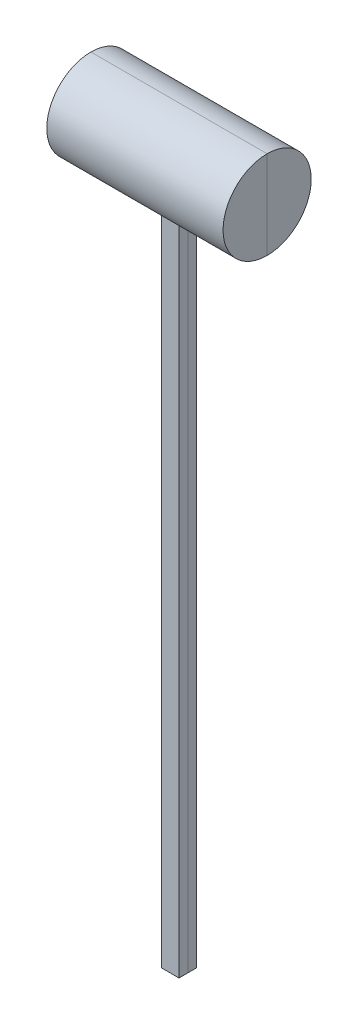
from build123d import *

# Parameters (mm, degrees)
SKETCH1_R           = 5
BOSS_EXTRUDE1_DEPTH = 10
SKETCH2_W           = 2
SKETCH2_H           = 80
BOSS_EXTRUDE2_DEPTH = 1


with BuildPart() as part:
    # Sketch1 → Boss-Extrude1 (new, symmetric)
    with BuildSketch(Plane(origin=(0, 0, 0), x_dir=(0, 0, -1), z_dir=(1, 0, 0))):
        Circle(SKETCH1_R)
    extrude(amount=BOSS_EXTRUDE1_DEPTH, both=True)

    # Sketch2 → Boss-Extrude2 (add, symmetric)
    with BuildSketch(Plane.XY):
        with Locations((0, -40)):
            Rectangle(SKETCH2_W, SKETCH2_H)
    extrude(amount=BOSS_EXTRUDE2_DEPTH, both=True)


with BuildPart() as body_2:
    # Split1: the piece on the far side of the plane
    add(part.part)
    split(bisect_by=Plane.XY, keep=Keep.BOTTOM)


with BuildPart() as part_1:
    add(part.part)

    # Split1
    split(bisect_by=Plane.XY, keep=Keep.TOP)


solid = Compound([body_2.part, part_1.part])
